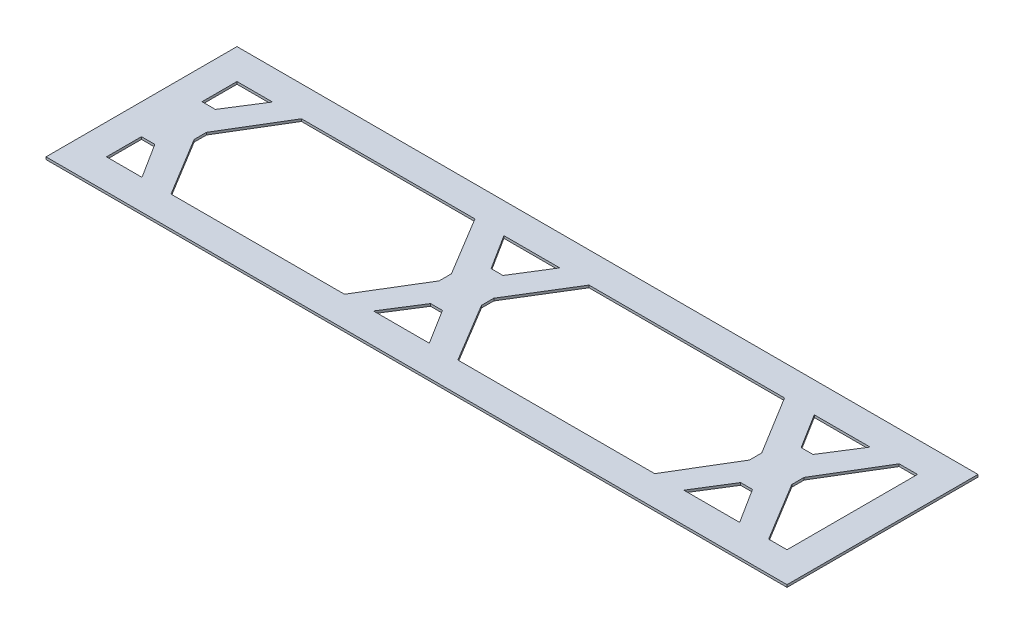
from build123d import *

# Parameters (mm, degrees)
SKETCH1_W           = 311.15
SKETCH1_H           = 80.191313252
BOSS_EXTRUDE1_DEPTH = 1


with BuildPart() as part:
    # Sketch1 → Boss-Extrude1 (new body)
    with BuildSketch(Plane(origin=(0, 0, 0), x_dir=(1, 0, 0), z_dir=(0, 1, 0))):
        with Locations((155.575, 40.095656626)):
            Rectangle(SKETCH1_W, SKETCH1_H)
        Polygon((12.7, 52.8066), (18.310796472, 52.8066), (27.609157985, 67.491313252), (12.7, 67.491313252), align=None, mode=Mode.SUBTRACT)
        Polygon((12.7, 12.7), (27.609157985, 12.7), (18.310796472, 27.384713252), (12.7, 27.384713252), align=None, mode=Mode.SUBTRACT)
        Polygon((39.78500573, 12.7), (112.61499427, 12.7), (127.635, 37.424696429), (127.635, 42.599313252), (112.61499427, 67.491313252), (39.78500573, 67.491313252), (24.765, 42.599313252), (24.765, 37.424696429), align=None, mode=Mode.SUBTRACT)
        Polygon((134.089203528, 27.384713252), (139.081919808, 27.384713252), (148.242867112, 12.7), (124.790842015, 12.7), align=None, mode=Mode.SUBTRACT)
        Polygon((124.790842015, 67.491313252), (134.089203528, 52.8066), (139.081919808, 52.8066), (148.242867112, 67.491313252), align=None, mode=Mode.SUBTRACT)
        Polygon((160.625882169, 67.376840045), (242.726117831, 67.376840045), (257.937, 42.599313252), (257.937, 37.424696429), (242.987396137, 12.586149763), (160.364603863, 12.586149763), (145.415, 37.424696429), (145.415, 42.599313252), align=None, mode=Mode.SUBTRACT)
        Polygon((255.109132888, 67.491313252), (264.270080192, 52.8066), (269.262796472, 52.8066), (278.561157985, 67.491313252), align=None, mode=Mode.SUBTRACT)
        Polygon((264.270080192, 27.384713252), (269.262796472, 27.384713252), (278.561157985, 12.7), (255.109132888, 12.7), align=None, mode=Mode.SUBTRACT)
        Polygon((298.45, 67.491313252), (298.45, 12.7), (290.73700573, 12.7), (275.717, 37.424696429), (275.717, 42.599313252), (290.73700573, 67.491313252), align=None, mode=Mode.SUBTRACT)
    extrude(amount=BOSS_EXTRUDE1_DEPTH)


solid = part.part
